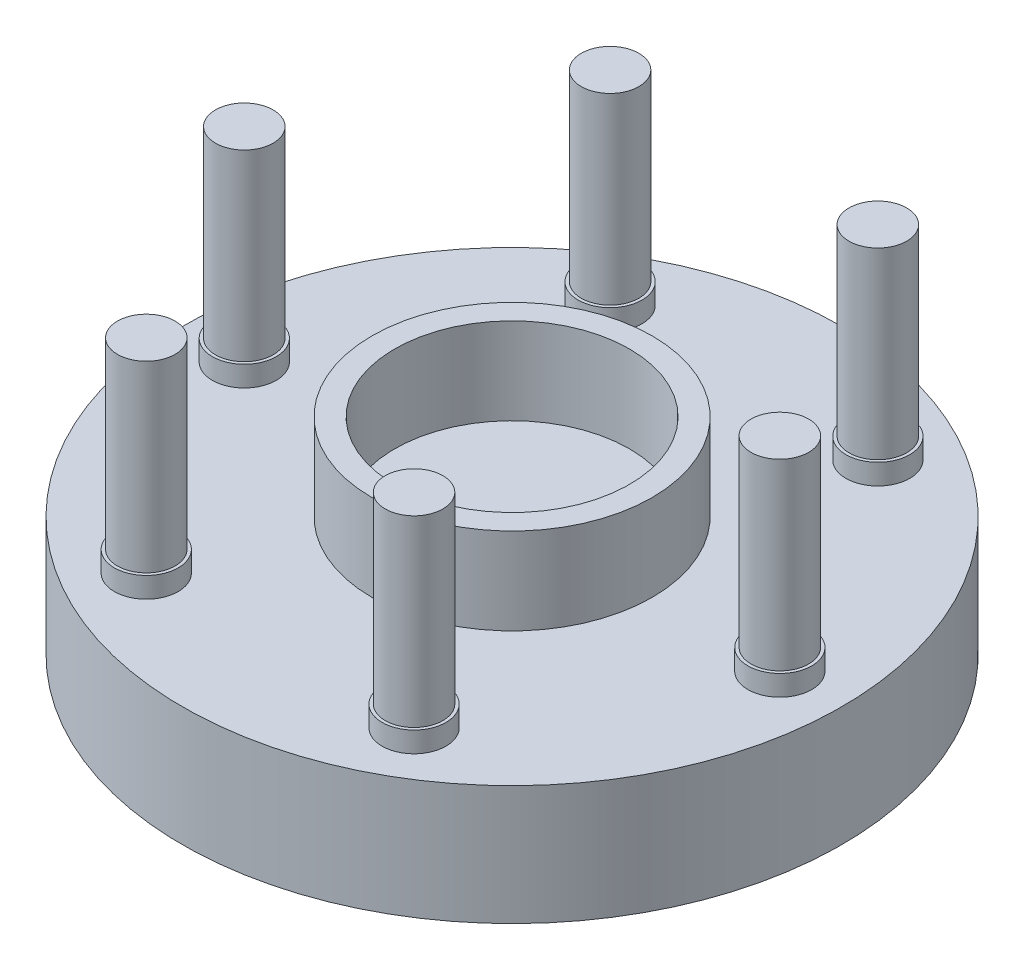
from build123d import *

# Parameters (mm, degrees)
SKETCH1_R           = 80
BOSS_EXTRUDE1_DEPTH = 29
SKETCH2_R           = 34
SKETCH2_R_2         = 28.5
BOSS_EXTRUDE2_DEPTH = 21
SKETCH3_R           = 7.75
BOSS_EXTRUDE3_DEPTH = 5
SKETCH4_R           = 7
BOSS_EXTRUDE4_DEPTH = 44.5


with BuildPart() as part:
    # Sketch1 → Boss-Extrude1 (new body)
    with BuildSketch(Plane(origin=(0, 0, 0), x_dir=(1, 0, 0), z_dir=(0, 1, 0))):
        with Locations(Location((0, 0, 0), (0, 0, 90))):
            Circle(SKETCH1_R)
    extrude(amount=BOSS_EXTRUDE1_DEPTH)

    # Sketch2 → Boss-Extrude2 (add)
    with BuildSketch(Plane(origin=(0, 29, 0), x_dir=(1, 0, 0), z_dir=(0, 1, 0))):
        with Locations(Location((0, 0, 0), (0, 0, 90))):
            Circle(SKETCH2_R)
        with Locations(Location((0, 0, 0), (0, 0, 90))):
            Circle(SKETCH2_R_2, mode=Mode.SUBTRACT)
    extrude(amount=BOSS_EXTRUDE2_DEPTH)

    # Sketch3 → Boss-Extrude3 (add)
    with BuildSketch(Plane(origin=(0, 29, 0), x_dir=(1, 0, 0), z_dir=(0, 1, 0))):
        with Locations(Location((65, 0, 0), (0, 0, 270))):
            Circle(SKETCH3_R)
        with Locations(Location((32.5, -56.291651246, 0), (0, 0, 270))):
            Circle(SKETCH3_R)
        with Locations(Location((-32.5, -56.291651246, 0), (0, 0, 270))):
            Circle(SKETCH3_R)
        with Locations(Location((-65, 0, 0), (0, 0, 270))):
            Circle(SKETCH3_R)
        with Locations(Location((-32.5, 56.291651246, 0), (0, 0, 270))):
            Circle(SKETCH3_R)
        with Locations(Location((32.5, 56.291651246, 0), (0, 0, 270))):
            Circle(SKETCH3_R)
    extrude(amount=BOSS_EXTRUDE3_DEPTH)

    # Sketch4 → Boss-Extrude4 (add)
    with BuildSketch(Plane(origin=(0, 34, 0), x_dir=(1, 0, 0), z_dir=(0, 1, 0))):
        with Locations(Location((65, 0, 0), (0, 0, 270))):
            Circle(SKETCH4_R)
        with Locations(Location((32.5, -56.291651246, 0), (0, 0, 270))):
            Circle(SKETCH4_R)
        with Locations(Location((-32.5, -56.291651246, 0), (0, 0, 270))):
            Circle(SKETCH4_R)
        with Locations(Location((-65, 0, 0), (0, 0, 270))):
            Circle(SKETCH4_R)
        with Locations(Location((-32.5, 56.291651246, 0), (0, 0, 270))):
            Circle(SKETCH4_R)
        with Locations(Location((32.5, 56.291651246, 0), (0, 0, 270))):
            Circle(SKETCH4_R)
    extrude(amount=BOSS_EXTRUDE4_DEPTH)


solid = part.part
